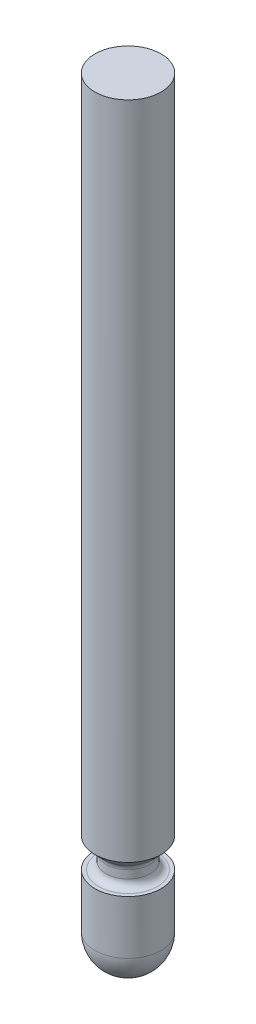
from build123d import *

# Parameters (mm, degrees)
SKETCH1_R           = 3.556
BOSS_EXTRUDE1_DEPTH = 83.53298
FILLET1_R           = 3.556


with BuildPart() as part:
    # Sketch1 → Boss-Extrude1 (new body)
    with BuildSketch(Plane(origin=(0, 0, 0), x_dir=(1, 0, 0), z_dir=(0, 1, 0))):
        with Locations(Location((0, 0, 0), (0, 0, 270))):
            Circle(SKETCH1_R)
    extrude(amount=BOSS_EXTRUDE1_DEPTH)

    # Sketch2 → Cut-Revolve2 (revolve, cut)
    with BuildSketch(Plane(origin=(0, 100.014806598, -21.087436426), x_dir=(0, -1, 0), z_dir=(1, 0, 0))):
        with BuildLine():
            Line((90.695546598, -17.531436426), (87.520546598, -17.531436426))
            Line((87.520546598, -17.531436426), (88.478687606, -18.489577434))
            ThreePointArc((88.478687606, -18.489577434), (88.736198639, -18.661640805), (89.039953613, -18.722061426))
            Line((89.039953613, -18.722061426), (89.901796598, -18.722061426))
            ThreePointArc((89.901796598, -18.722061426), (90.463062606, -18.489577434), (90.695546598, -17.928311426))
            Line((90.695546598, -17.928311426), (90.695546598, -17.531436426))
        make_face()
    revolve(axis=Axis((0, 0, 0), (0, 1, 0)), mode=Mode.SUBTRACT)

    # Fillet1
    fillet1_edges = [part.edges().sort_by_distance(p)[0] for p in [
        (0, 0, -3.556),
    ]]
    fillet(fillet1_edges, radius=FILLET1_R)


solid = part.part
